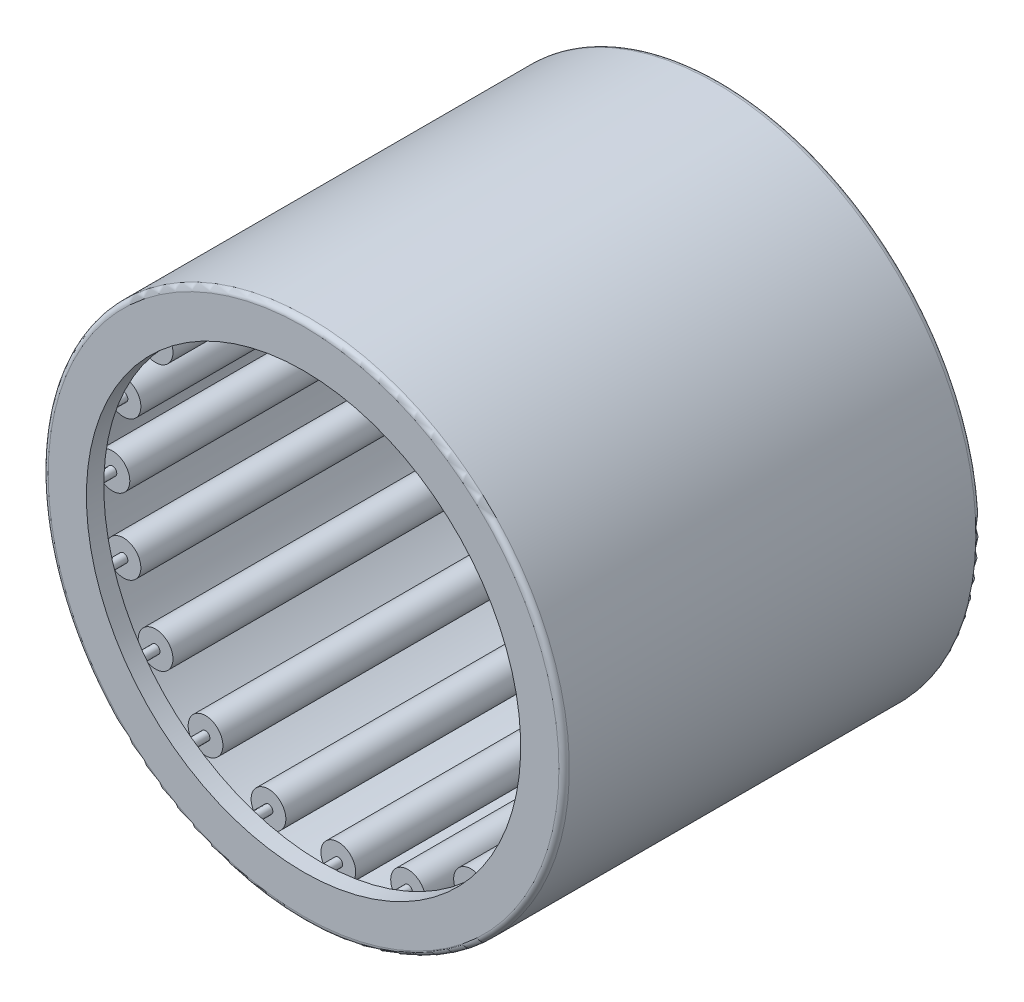
from build123d import *

# Parameters (mm, degrees)
SKETCH2_W         = 21.166666666
SKETCH2_H         = 0.79375
SKETCH3_W         = 23.283333334
SKETCH3_H         = 0.264583334
CIRPATTERN1_COUNT = 20
CIRPATTERN1_ANGLE = 342
FILLET1_R         = 0.3175


with BuildPart() as part:
    # Sketch1 → Revolve1 (revolve)
    with BuildSketch(Plane(origin=(0, 0, 0), x_dir=(0, 0, -1), z_dir=(1, 0, 0))):
        Polygon((-12.7, 15.875), (12.7, 15.875), (12.7, 13.229166667), (11.641666667, 13.229166667), (11.641666667, 14.816666667), (-11.641666667, 14.816666667), (-11.641666667, 13.229166667), (-12.7, 13.229166667), align=None)
    revolve(axis=Axis((0, 0, 12.7), (0, 0, -1)))

    # Fillet1
    fillet1_edges = [part.edges().sort_by_distance(p)[0] for p in [
        (0, -15.875, -12.7),
        (0, -15.875, 12.7),
    ]]
    fillet(fillet1_edges, radius=FILLET1_R)


with BuildPart() as body_2:
    # Sketch2 → Revolve2 (revolve)
    with BuildSketch(Plane(origin=(0, 0, 0), x_dir=(0, 0, -1), z_dir=(1, 0, 0))):
        with Locations((0, 14.419791667)):
            Rectangle(SKETCH2_W, SKETCH2_H)
    revolve(axis=Axis((0, 13.758333333, 10.583333333), (0, 0, -1)))


with BuildPart() as body_3:
    # Sketch3 → Revolve3 (revolve)
    with BuildSketch(Plane(origin=(0, 0, 0), x_dir=(0, 0, -1), z_dir=(1, 0, 0))):
        with Locations((0, 13.890625)):
            Rectangle(SKETCH3_W, SKETCH3_H)
    revolve(axis=Axis((0, 13.758333333, 11.641666667), (0, 0, -1)))


with BuildPart() as cirpattern1_1:
    # CirPattern1: pattern copy
    add(body_2.part.rotate(Axis((0, 0, -12.7), (0, 0, 1)), 1 * CIRPATTERN1_ANGLE / (CIRPATTERN1_COUNT - 1)))


with BuildPart() as cirpattern1_2:
    # CirPattern1: pattern copy
    add(body_2.part.rotate(Axis((0, 0, -12.7), (0, 0, 1)), 2 * CIRPATTERN1_ANGLE / (CIRPATTERN1_COUNT - 1)))


with BuildPart() as cirpattern1_3:
    # CirPattern1: pattern copy
    add(body_2.part.rotate(Axis((0, 0, -12.7), (0, 0, 1)), 3 * CIRPATTERN1_ANGLE / (CIRPATTERN1_COUNT - 1)))


with BuildPart() as cirpattern1_4:
    # CirPattern1: pattern copy
    add(body_2.part.rotate(Axis((0, 0, -12.7), (0, 0, 1)), 4 * CIRPATTERN1_ANGLE / (CIRPATTERN1_COUNT - 1)))


with BuildPart() as cirpattern1_5:
    # CirPattern1: pattern copy
    add(body_2.part.rotate(Axis((0, 0, -12.7), (0, 0, 1)), 5 * CIRPATTERN1_ANGLE / (CIRPATTERN1_COUNT - 1)))


with BuildPart() as cirpattern1_6:
    # CirPattern1: pattern copy
    add(body_2.part.rotate(Axis((0, 0, -12.7), (0, 0, 1)), 6 * CIRPATTERN1_ANGLE / (CIRPATTERN1_COUNT - 1)))


with BuildPart() as cirpattern1_7:
    # CirPattern1: pattern copy
    add(body_2.part.rotate(Axis((0, 0, -12.7), (0, 0, 1)), 7 * CIRPATTERN1_ANGLE / (CIRPATTERN1_COUNT - 1)))


with BuildPart() as cirpattern1_8:
    # CirPattern1: pattern copy
    add(body_2.part.rotate(Axis((0, 0, -12.7), (0, 0, 1)), 8 * CIRPATTERN1_ANGLE / (CIRPATTERN1_COUNT - 1)))


with BuildPart() as cirpattern1_9:
    # CirPattern1: pattern copy
    add(body_2.part.rotate(Axis((0, 0, -12.7), (0, 0, 1)), 9 * CIRPATTERN1_ANGLE / (CIRPATTERN1_COUNT - 1)))


with BuildPart() as cirpattern1_10:
    # CirPattern1: pattern copy
    add(body_2.part.rotate(Axis((0, 0, -12.7), (0, 0, 1)), 10 * CIRPATTERN1_ANGLE / (CIRPATTERN1_COUNT - 1)))


with BuildPart() as cirpattern1_11:
    # CirPattern1: pattern copy
    add(body_2.part.rotate(Axis((0, 0, -12.7), (0, 0, 1)), 11 * CIRPATTERN1_ANGLE / (CIRPATTERN1_COUNT - 1)))


with BuildPart() as cirpattern1_12:
    # CirPattern1: pattern copy
    add(body_2.part.rotate(Axis((0, 0, -12.7), (0, 0, 1)), 12 * CIRPATTERN1_ANGLE / (CIRPATTERN1_COUNT - 1)))


with BuildPart() as cirpattern1_13:
    # CirPattern1: pattern copy
    add(body_2.part.rotate(Axis((0, 0, -12.7), (0, 0, 1)), 13 * CIRPATTERN1_ANGLE / (CIRPATTERN1_COUNT - 1)))


with BuildPart() as cirpattern1_14:
    # CirPattern1: pattern copy
    add(body_2.part.rotate(Axis((0, 0, -12.7), (0, 0, 1)), 14 * CIRPATTERN1_ANGLE / (CIRPATTERN1_COUNT - 1)))


with BuildPart() as cirpattern1_15:
    # CirPattern1: pattern copy
    add(body_2.part.rotate(Axis((0, 0, -12.7), (0, 0, 1)), 15 * CIRPATTERN1_ANGLE / (CIRPATTERN1_COUNT - 1)))


with BuildPart() as cirpattern1_16:
    # CirPattern1: pattern copy
    add(body_2.part.rotate(Axis((0, 0, -12.7), (0, 0, 1)), 16 * CIRPATTERN1_ANGLE / (CIRPATTERN1_COUNT - 1)))


with BuildPart() as cirpattern1_17:
    # CirPattern1: pattern copy
    add(body_2.part.rotate(Axis((0, 0, -12.7), (0, 0, 1)), 17 * CIRPATTERN1_ANGLE / (CIRPATTERN1_COUNT - 1)))


with BuildPart() as cirpattern1_18:
    # CirPattern1: pattern copy
    add(body_2.part.rotate(Axis((0, 0, -12.7), (0, 0, 1)), 18 * CIRPATTERN1_ANGLE / (CIRPATTERN1_COUNT - 1)))


with BuildPart() as cirpattern1_19:
    # CirPattern1: pattern copy
    add(body_2.part.rotate(Axis((0, 0, -12.7), (0, 0, 1)), 19 * CIRPATTERN1_ANGLE / (CIRPATTERN1_COUNT - 1)))


with BuildPart() as cirpattern1_20:
    # CirPattern1: pattern copy
    add(body_3.part.rotate(Axis((0, 0, -12.7), (0, 0, 1)), 1 * CIRPATTERN1_ANGLE / (CIRPATTERN1_COUNT - 1)))


with BuildPart() as cirpattern1_21:
    # CirPattern1: pattern copy
    add(body_3.part.rotate(Axis((0, 0, -12.7), (0, 0, 1)), 2 * CIRPATTERN1_ANGLE / (CIRPATTERN1_COUNT - 1)))


with BuildPart() as cirpattern1_22:
    # CirPattern1: pattern copy
    add(body_3.part.rotate(Axis((0, 0, -12.7), (0, 0, 1)), 3 * CIRPATTERN1_ANGLE / (CIRPATTERN1_COUNT - 1)))


with BuildPart() as cirpattern1_23:
    # CirPattern1: pattern copy
    add(body_3.part.rotate(Axis((0, 0, -12.7), (0, 0, 1)), 4 * CIRPATTERN1_ANGLE / (CIRPATTERN1_COUNT - 1)))


with BuildPart() as cirpattern1_24:
    # CirPattern1: pattern copy
    add(body_3.part.rotate(Axis((0, 0, -12.7), (0, 0, 1)), 5 * CIRPATTERN1_ANGLE / (CIRPATTERN1_COUNT - 1)))


with BuildPart() as cirpattern1_25:
    # CirPattern1: pattern copy
    add(body_3.part.rotate(Axis((0, 0, -12.7), (0, 0, 1)), 6 * CIRPATTERN1_ANGLE / (CIRPATTERN1_COUNT - 1)))


with BuildPart() as cirpattern1_26:
    # CirPattern1: pattern copy
    add(body_3.part.rotate(Axis((0, 0, -12.7), (0, 0, 1)), 7 * CIRPATTERN1_ANGLE / (CIRPATTERN1_COUNT - 1)))


with BuildPart() as cirpattern1_27:
    # CirPattern1: pattern copy
    add(body_3.part.rotate(Axis((0, 0, -12.7), (0, 0, 1)), 8 * CIRPATTERN1_ANGLE / (CIRPATTERN1_COUNT - 1)))


with BuildPart() as cirpattern1_28:
    # CirPattern1: pattern copy
    add(body_3.part.rotate(Axis((0, 0, -12.7), (0, 0, 1)), 9 * CIRPATTERN1_ANGLE / (CIRPATTERN1_COUNT - 1)))


with BuildPart() as cirpattern1_29:
    # CirPattern1: pattern copy
    add(body_3.part.rotate(Axis((0, 0, -12.7), (0, 0, 1)), 10 * CIRPATTERN1_ANGLE / (CIRPATTERN1_COUNT - 1)))


with BuildPart() as cirpattern1_30:
    # CirPattern1: pattern copy
    add(body_3.part.rotate(Axis((0, 0, -12.7), (0, 0, 1)), 11 * CIRPATTERN1_ANGLE / (CIRPATTERN1_COUNT - 1)))


with BuildPart() as cirpattern1_31:
    # CirPattern1: pattern copy
    add(body_3.part.rotate(Axis((0, 0, -12.7), (0, 0, 1)), 12 * CIRPATTERN1_ANGLE / (CIRPATTERN1_COUNT - 1)))


with BuildPart() as cirpattern1_32:
    # CirPattern1: pattern copy
    add(body_3.part.rotate(Axis((0, 0, -12.7), (0, 0, 1)), 13 * CIRPATTERN1_ANGLE / (CIRPATTERN1_COUNT - 1)))


with BuildPart() as cirpattern1_33:
    # CirPattern1: pattern copy
    add(body_3.part.rotate(Axis((0, 0, -12.7), (0, 0, 1)), 14 * CIRPATTERN1_ANGLE / (CIRPATTERN1_COUNT - 1)))


with BuildPart() as cirpattern1_34:
    # CirPattern1: pattern copy
    add(body_3.part.rotate(Axis((0, 0, -12.7), (0, 0, 1)), 15 * CIRPATTERN1_ANGLE / (CIRPATTERN1_COUNT - 1)))


with BuildPart() as cirpattern1_35:
    # CirPattern1: pattern copy
    add(body_3.part.rotate(Axis((0, 0, -12.7), (0, 0, 1)), 16 * CIRPATTERN1_ANGLE / (CIRPATTERN1_COUNT - 1)))


with BuildPart() as cirpattern1_36:
    # CirPattern1: pattern copy
    add(body_3.part.rotate(Axis((0, 0, -12.7), (0, 0, 1)), 17 * CIRPATTERN1_ANGLE / (CIRPATTERN1_COUNT - 1)))


with BuildPart() as cirpattern1_37:
    # CirPattern1: pattern copy
    add(body_3.part.rotate(Axis((0, 0, -12.7), (0, 0, 1)), 18 * CIRPATTERN1_ANGLE / (CIRPATTERN1_COUNT - 1)))


with BuildPart() as cirpattern1_38:
    # CirPattern1: pattern copy
    add(body_3.part.rotate(Axis((0, 0, -12.7), (0, 0, 1)), 19 * CIRPATTERN1_ANGLE / (CIRPATTERN1_COUNT - 1)))


solid = Compound([part.part, body_2.part, body_3.part, cirpattern1_1.part, cirpattern1_2.part, cirpattern1_3.part, cirpattern1_4.part, cirpattern1_5.part, cirpattern1_6.part, cirpattern1_7.part, cirpattern1_8.part, cirpattern1_9.part, cirpattern1_10.part, cirpattern1_11.part, cirpattern1_12.part, cirpattern1_13.part, cirpattern1_14.part, cirpattern1_15.part, cirpattern1_16.part, cirpattern1_17.part, cirpattern1_18.part, cirpattern1_19.part, cirpattern1_20.part, cirpattern1_21.part, cirpattern1_22.part, cirpattern1_23.part, cirpattern1_24.part, cirpattern1_25.part, cirpattern1_26.part, cirpattern1_27.part, cirpattern1_28.part, cirpattern1_29.part, cirpattern1_30.part, cirpattern1_31.part, cirpattern1_32.part, cirpattern1_33.part, cirpattern1_34.part, cirpattern1_35.part, cirpattern1_36.part, cirpattern1_37.part, cirpattern1_38.part])
